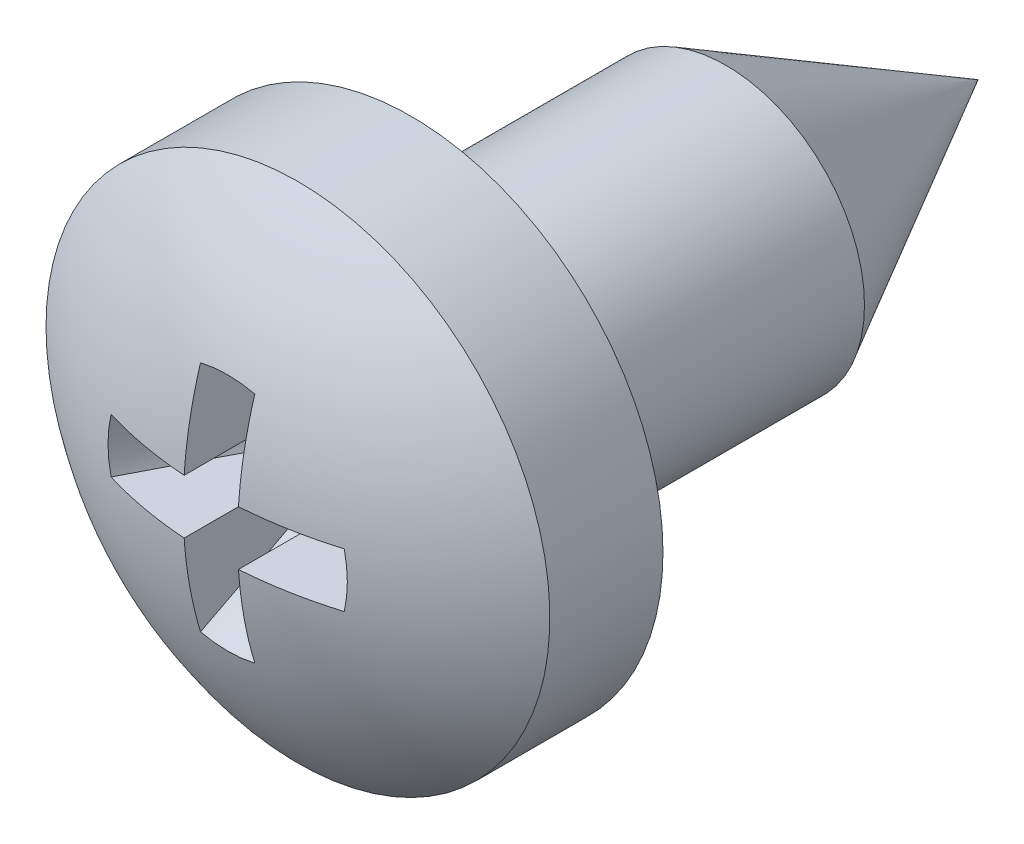
from build123d import *

# Parameters (mm, degrees)
SLOT_DEPTH        = 1.9
CIRPATTERN1_COUNT = 4
CHAMFER1_SIZE     = 2
CHAMFER1_SIZE2    = 1.099
FILLET1_R         = 0.1


with BuildPart() as part:
    # Sketch1 → BaseBody (revolve)
    with BuildSketch(Plane(origin=(0, 0, 0), x_dir=(0, 0, -1), z_dir=(1, 0, 0)), mode=Mode.PRIVATE) as basebody_sk:
        with BuildLine():
            Line((0.702000801, 2), (1.6, 2))
            Line((1.6, 2), (1.6, 1.1))
            Line((1.6, 1.1), (6.1, 1.1))
            Line((6.1, 1.1), (6.1, 0))
            Line((6.1, 0), (0, 0))
            ThreePointArc((0, 0), (0.180596297, 1.059811908), (0.702000801, 2))
        make_face()
    revolve(basebody_sk.sketch.rotate(Axis((0, 0, -104.616192041), (0, 0, 1)), 90), axis=Axis((0, 0, -104.616192041), (0, 0, 1)))

    # Sketch2 → Slot (cut)
    with BuildSketch(Plane.XY):
        with BuildLine():
            Line((-0.215667568, 0.925195925), (-0.215667568, 0))
            Line((-0.215667568, 0), (0.215667568, 0))
            Line((0.215667568, 0), (0.215667568, 0.925195925))
            ThreePointArc((0.215667568, 0.925195925), (0, 0.95), (-0.215667568, 0.925195925))
        make_face()
    slot = extrude(amount=-SLOT_DEPTH, mode=Mode.SUBTRACT)

    # CirPattern1: Slot ×4 about axis
    cirpattern1_axis = Axis((0, 0, 0), (0, 0, 1))
    for i in range(1, CIRPATTERN1_COUNT):
        add(slot.rotate(cirpattern1_axis, i * 360 / CIRPATTERN1_COUNT), mode=Mode.SUBTRACT)

    # Sketch4 → BaseBodySlot (revolve)
    with BuildSketch(Plane(origin=(0, 0, 0), x_dir=(0, 0, -1), z_dir=(1, 0, 0)), mode=Mode.PRIVATE) as basebodyslot_sk:
        with BuildLine():
            Line((0.625121362, 1.9), (1.6, 1.9))
            Line((1.6, 1.9), (1.6, 1.1))
            Line((1.6, 1.1), (1.91, 1.1))
            Line((1.91, 1.1), (1.91, 0))
            Line((1.91, 0), (1.452710893, 0))
            Line((1.452710893, 0), (1.237368573, 0.405))
            Line((1.237368573, 0.405), (0.144267682, 0.95))
            ThreePointArc((0.144267682, 0.95), (0.344904566, 1.445140154), (0.625121362, 1.9))
        make_face()
    revolve(basebodyslot_sk.sketch.rotate(Axis((0, 0, -5.068214653), (0, 0, 1)), 346.878398747), axis=Axis((0, 0, -5.068214653), (0, 0, 1)))

    # Chamfer1
    chamfer1_edges = [part.edges().sort_by_distance(p)[0] for p in [
        (1.1, 0, -6.1),
    ]]
    chamfer1_side = [part.faces().sort_by_distance(p)[0] for p in [
        (1.1, 0, -3.85),
    ]]
    chamfer(chamfer1_edges, length=CHAMFER1_SIZE, length2=CHAMFER1_SIZE2, reference=chamfer1_side[0])

    # Fillet1
    fillet1_edges = [part.edges().sort_by_distance(p)[0] for p in [
        (1.1, 0, -1.6),
    ]]
    fillet(fillet1_edges, radius=FILLET1_R)


solid = part.part
